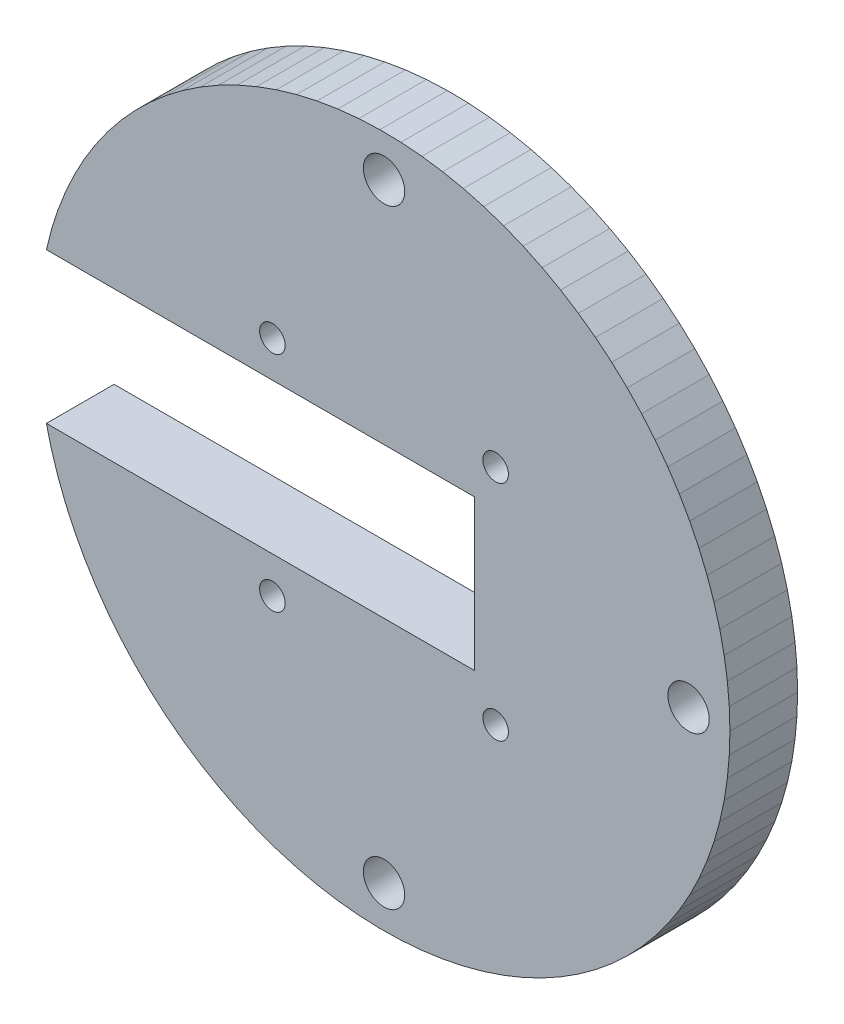
from build123d import *

# Parameters (mm, degrees)
SKETCH_1_R        = 3.75
SKETCH_1_R_2      = 2.75
EXTRUDE_422_DEPTH = 4
EXTRUDE_START     = 4
SKETCH_2_R        = 1.7
SKETCH_2_R_2      = 2.75
EXTRUDE_698_DEPTH = 5


with BuildPart() as part:
    # 草图1 → Extrude 422 (new body)
    with BuildSketch(Plane.XY):
        Polygon((-44.899888641, -10), (-44.2082264, -12.713485699), (-43.352738806, -15.379858192), (-42.336596099, -17.989236526), (-41.163563864, -20.531950955), (-39.837989085, -22.998578775), (-38.364784033, -25.379979238), (-36.74940806, -27.667327432), (-34.997847373, -29.852146979), (-33.116592846, -31.926341448), (-31.112615968, -33.882224361), (-28.993343009, -35.712547671), (-26.7666275, -37.410528629), (-24.440721127, -38.969874914), (-22.024243155, -40.384807953), (-19.526148488, -41.650084336), (-16.955694479, -42.761015244), (-14.322406631, -43.713483827), (-11.636043292, -44.503960459), (-8.906559497, -45.129515818), (-6.144070075, -45.587831742), (-3.358812166, -45.87720982), (-0.561107284, -45.996577684), (2.238676931, -45.945492985), (5.030165132, -45.72414503), (7.803012717, -45.333354084), (10.546944161, -44.774568327), (13.251791096, -44.049858487), (15.907529991, -43.161910171), (18.504319299, -42.114013906), (21.032535927, -40.910052952), (23.482810893, -39.554488905), (25.846064052, -38.052345171), (28.11353774, -36.409188342), (30.276829231, -34.631107573), (32.327921871, -32.724692016), (34.25921479, -30.697006401), (36.063551069, -28.555564857), (37.734244259, -26.308303066), (39.265103162, -23.963548854), (40.650454772, -21.529991333), (41.885165301, -19.016648698), (42.9646592, -16.432834808), (43.884936117, -13.788124675), (44.64258572, -11.092318975), (45.234800338, -8.355407734), (45.659385361, -5.587533306), (45.914767377, -2.798952785), (46, 0), (45.914767377, 2.798952785), (45.659385361, 5.587533306), (45.234800338, 8.355407734), (44.64258572, 11.092318975), (43.884936117, 13.788124675), (42.9646592, 16.432834808), (41.885165301, 19.016648698), (40.650454772, 21.529991333), (39.265103162, 23.963548854), (37.734244259, 26.308303066), (36.063551069, 28.555564857), (34.25921479, 30.697006401), (32.327921871, 32.724692016), (30.276829231, 34.631107573), (28.11353774, 36.409188342), (25.846064052, 38.052345171), (23.482810893, 39.554488905), (21.032535927, 40.910052952), (18.504319299, 42.114013906), (15.907529991, 43.161910171), (13.251791096, 44.049858487), (10.546944161, 44.774568327), (7.803012717, 45.333354084), (5.030165132, 45.72414503), (2.238676931, 45.945492985), (-0.561107284, 45.996577684), (-3.358812166, 45.87720982), (-6.144070075, 45.587831742), (-8.906559497, 45.129515818), (-11.636043292, 44.503960459), (-14.322406631, 43.713483827), (-16.955694479, 42.761015244), (-19.526148488, 41.650084336), (-22.024243155, 40.384807953), (-24.440721127, 38.969874914), (-26.7666275, 37.410528629), (-28.993343009, 35.712547671), (-31.112615968, 33.882224361), (-33.116592846, 31.926341448), (-34.997847373, 29.852146979), (-36.74940806, 27.667327432), (-38.364784033, 25.379979238), (-39.837989085, 22.998578775), (-41.163563864, 20.531950955), (-42.336596099, 17.989236526), (-43.352738806, 15.379858192), (-44.2082264, 12.713485699), (-44.899888641, 10), (12, 10), (12, -10), align=None)
        with Locations((-14.845, -14.845)):
            Circle(SKETCH_1_R, mode=Mode.SUBTRACT)
        with Locations((-14.845, 14.845)):
            Circle(SKETCH_1_R, mode=Mode.SUBTRACT)
        with Locations((14.845, -14.845)):
            Circle(SKETCH_1_R, mode=Mode.SUBTRACT)
        with Locations((14.845, 14.845)):
            Circle(SKETCH_1_R, mode=Mode.SUBTRACT)
        with Locations((0, -40.5)):
            Circle(SKETCH_1_R_2, mode=Mode.SUBTRACT)
        with Locations((0, 40.5)):
            Circle(SKETCH_1_R_2, mode=Mode.SUBTRACT)
        with Locations((40.5, 0)):
            Circle(SKETCH_1_R_2, mode=Mode.SUBTRACT)
    extrude(amount=EXTRUDE_422_DEPTH)

    # 草图2 → Extrude 698 (add)
    with BuildSketch(Plane.XY.offset(EXTRUDE_START)):
        Polygon((-44.899888641, -10), (-44.2082264, -12.713485699), (-43.352738806, -15.379858192), (-42.336596099, -17.989236526), (-41.163563864, -20.531950955), (-39.837989085, -22.998578775), (-38.364784033, -25.379979238), (-36.74940806, -27.667327432), (-34.997847373, -29.852146979), (-33.116592846, -31.926341448), (-31.112615968, -33.882224361), (-28.993343009, -35.712547671), (-26.7666275, -37.410528629), (-24.440721127, -38.969874914), (-22.024243155, -40.384807953), (-19.526148488, -41.650084336), (-16.955694479, -42.761015244), (-14.322406631, -43.713483827), (-11.636043292, -44.503960459), (-8.906559497, -45.129515818), (-6.144070075, -45.587831742), (-3.358812166, -45.87720982), (-0.561107284, -45.996577684), (2.238676931, -45.945492985), (5.030165132, -45.72414503), (7.803012717, -45.333354084), (10.546944161, -44.774568327), (13.251791096, -44.049858487), (15.907529991, -43.161910171), (18.504319299, -42.114013906), (21.032535927, -40.910052952), (23.482810893, -39.554488905), (25.846064052, -38.052345171), (28.11353774, -36.409188342), (30.276829231, -34.631107573), (32.327921871, -32.724692016), (34.25921479, -30.697006401), (36.063551069, -28.555564857), (37.734244259, -26.308303066), (39.265103162, -23.963548854), (40.650454772, -21.529991333), (41.885165301, -19.016648698), (42.9646592, -16.432834808), (43.884936117, -13.788124675), (44.64258572, -11.092318975), (45.234800338, -8.355407734), (45.659385361, -5.587533306), (45.914767377, -2.798952785), (46, 0), (45.914767377, 2.798952785), (45.659385361, 5.587533306), (45.234800338, 8.355407734), (44.64258572, 11.092318975), (43.884936117, 13.788124675), (42.9646592, 16.432834808), (41.885165301, 19.016648698), (40.650454772, 21.529991333), (39.265103162, 23.963548854), (37.734244259, 26.308303066), (36.063551069, 28.555564857), (34.25921479, 30.697006401), (32.327921871, 32.724692016), (30.276829231, 34.631107573), (28.11353774, 36.409188342), (25.846064052, 38.052345171), (23.482810893, 39.554488905), (21.032535927, 40.910052952), (18.504319299, 42.114013906), (15.907529991, 43.161910171), (13.251791096, 44.049858487), (10.546944161, 44.774568327), (7.803012717, 45.333354084), (5.030165132, 45.72414503), (2.238676931, 45.945492985), (-0.561107284, 45.996577684), (-3.358812166, 45.87720982), (-6.144070075, 45.587831742), (-8.906559497, 45.129515818), (-11.636043292, 44.503960459), (-14.322406631, 43.713483827), (-16.955694479, 42.761015244), (-19.526148488, 41.650084336), (-22.024243155, 40.384807953), (-24.440721127, 38.969874914), (-26.7666275, 37.410528629), (-28.993343009, 35.712547671), (-31.112615968, 33.882224361), (-33.116592846, 31.926341448), (-34.997847373, 29.852146979), (-36.74940806, 27.667327432), (-38.364784033, 25.379979238), (-39.837989085, 22.998578775), (-41.163563864, 20.531950955), (-42.336596099, 17.989236526), (-43.352738806, 15.379858192), (-44.2082264, 12.713485699), (-44.899888641, 10), (12, 10), (12, -10), align=None)
        with Locations((-14.845, -14.845)):
            Circle(SKETCH_2_R, mode=Mode.SUBTRACT)
        with Locations((-14.845, 14.845)):
            Circle(SKETCH_2_R, mode=Mode.SUBTRACT)
        with Locations((14.845, -14.845)):
            Circle(SKETCH_2_R, mode=Mode.SUBTRACT)
        with Locations((14.845, 14.845)):
            Circle(SKETCH_2_R, mode=Mode.SUBTRACT)
        with Locations((0, -40.5)):
            Circle(SKETCH_2_R_2, mode=Mode.SUBTRACT)
        with Locations((0, 40.5)):
            Circle(SKETCH_2_R_2, mode=Mode.SUBTRACT)
        with Locations((40.5, 0)):
            Circle(SKETCH_2_R_2, mode=Mode.SUBTRACT)
    extrude(amount=EXTRUDE_698_DEPTH)


solid = part.part
